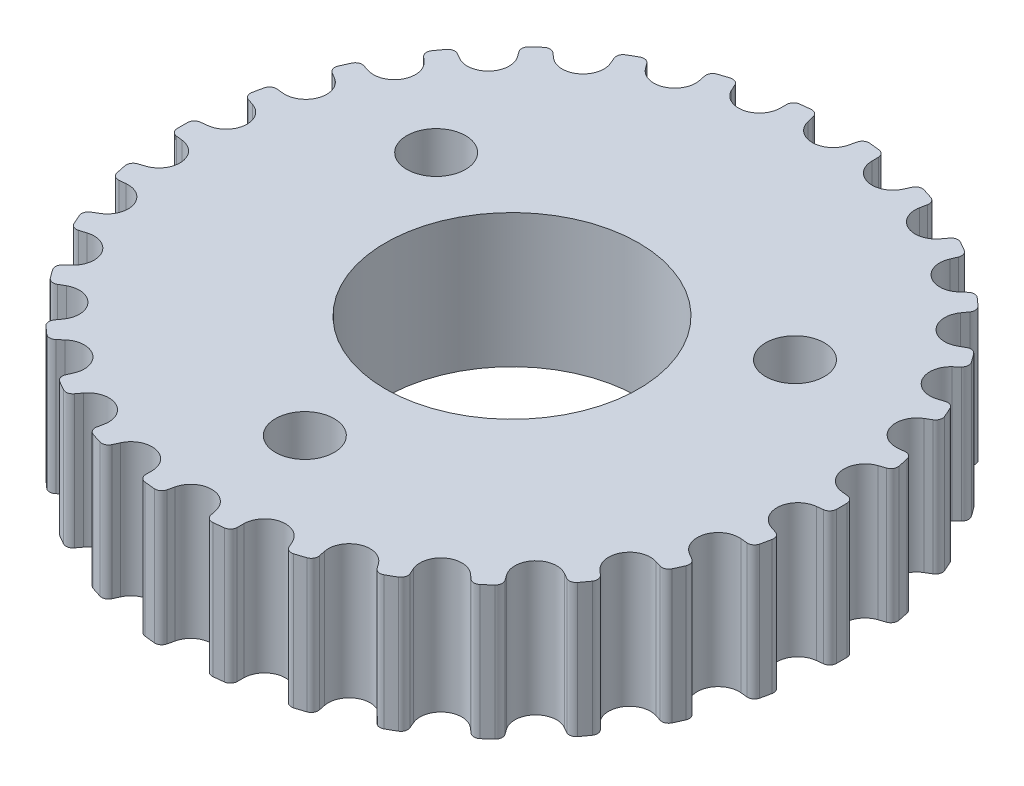
from build123d import *

# Parameters (mm, degrees)
SKETCH1_R           = 14.323944878
BOSS_EXTRUDE1_DEPTH = 5.8
CUT_EXTRUDE1_DEPTH  = 22.07108905
CIRPATTERN1_COUNT   = 30
SKETCH3_R           = 5.5
CUT_EXTRUDE2_DEPTH  = 22.033616305
SKETCH4_R           = 1.275
CUT_EXTRUDE3_DEPTH  = 22.033616305


with BuildPart() as part:
    # Sketch1 → Boss-Extrude1 (new body)
    with BuildSketch(Plane(origin=(0, 0, 0), x_dir=(1, 0, 0), z_dir=(0, 1, 0))):
        with Locations(Location((0, 0, 0), (0, 0, 270))):
            Circle(SKETCH1_R)
    extrude(amount=BOSS_EXTRUDE1_DEPTH)

    # Sketch2 → Cut-Extrude1 (cut, through all)
    with BuildSketch(Plane(origin=(0, 5.8, 0), x_dir=(1, 0, 0), z_dir=(0, 1, 0))):
        with BuildLine():
            Line((-0.88830444, 13.756422166), (-0.95, 14.033881093))
            ThreePointArc((-0.95, 14.033881093), (-1.065709647, 14.210883809), (-1.269434594, 14.267583281))
            ThreePointArc((-1.269434594, 14.267583281), (-2.127648488, 14.165045315), (-2.978115599, 14.010932316))
            Line((-2.978115599, 14.010932316), (-2.978115599, 14.323944878))
            Line((-2.978115599, 14.323944878), (2.978115599, 14.323944878))
            Line((2.978115599, 14.323944878), (2.978115599, 14.010932316))
            ThreePointArc((2.978115599, 14.010932316), (2.127648488, 14.165045315), (1.269434594, 14.267583281))
            ThreePointArc((1.269434594, 14.267583281), (1.065709647, 14.210883809), (0.95, 14.033881093))
            Line((0.95, 14.033881093), (0.88830444, 13.756422166))
            ThreePointArc((0.88830444, 13.756422166), (0, 13.043944878), (-0.88830444, 13.756422166))
        make_face()
    cut_extrude1 = extrude(amount=-CUT_EXTRUDE1_DEPTH, mode=Mode.SUBTRACT)

    # CirPattern1: Cut-Extrude1 ×30 about axis
    cirpattern1_axis = Axis((0, 0, 0), (0, 1, 0))
    for i in range(1, CIRPATTERN1_COUNT):
        add(cut_extrude1.rotate(cirpattern1_axis, i * 360 / CIRPATTERN1_COUNT), mode=Mode.SUBTRACT)

    # Sketch3 → Cut-Extrude2 (cut, through all)
    with BuildSketch(Plane.XZ):
        with Locations(Location((0, 0, 0), (0, 0, 270))):
            Circle(SKETCH3_R)
    extrude(amount=-CUT_EXTRUDE2_DEPTH, mode=Mode.SUBTRACT)

    # Sketch4 → Cut-Extrude3 (cut, through all)
    with BuildSketch(Plane.XZ):
        with Locations(Location((0, 9, 0), (0, 0, 270))):
            Circle(SKETCH4_R)
        with Locations(Location((7.794228634, -4.5, 0), (0, 0, 270))):
            Circle(SKETCH4_R)
        with Locations(Location((-7.794228634, -4.5, 0), (0, 0, 270))):
            Circle(SKETCH4_R)
    extrude(amount=-CUT_EXTRUDE3_DEPTH, mode=Mode.SUBTRACT)


solid = part.part
